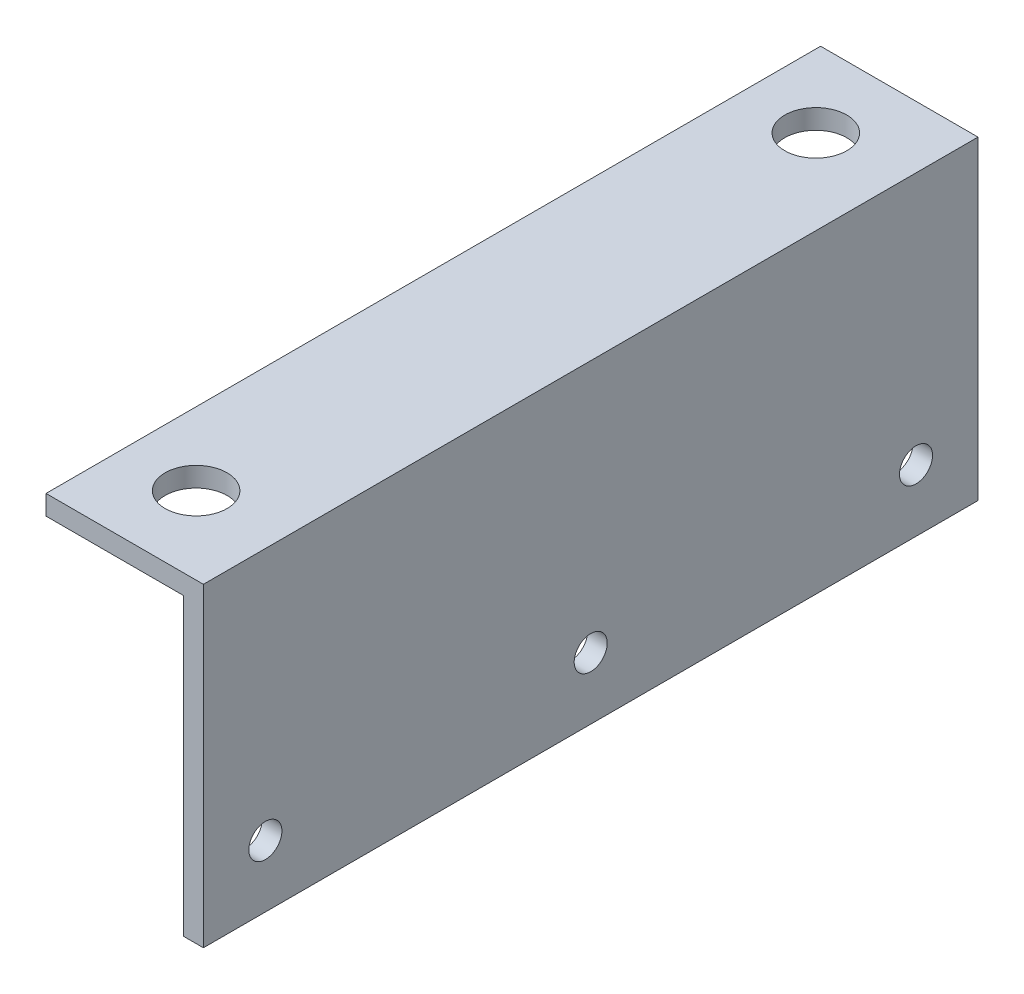
from build123d import *

# Parameters (mm, degrees)
BOSS_EXTRUDE1_DEPTH = 125
CUT_EXTRUDE1_REACH  = 139.298
SKETCH2_R           = 2.665
CUT_EXTRUDE2_REACH  = 139.298
SKETCH3_R           = 5


with BuildPart() as part:
    # Sketch1 → Boss-Extrude1 (new body)
    with BuildSketch(Plane.XY):
        Polygon((0, 0), (0, 50.8), (-25.4, 50.8), (-25.4, 47.625), (-3.175, 47.625), (-3.175, 0), align=None)
    extrude(amount=BOSS_EXTRUDE1_DEPTH)

    # Sketch2 → Cut-Extrude1 (cut, up to next)
    with BuildSketch(Plane(origin=(0, 0, 0), x_dir=(0, 0, -1), z_dir=(1, 0, 0)), mode=Mode.PRIVATE) as cut_extrude1_sk1:
        with Locations((-115, 10)):
            Circle(SKETCH2_R)
    cut_extrude1_tool1 = extrude(cut_extrude1_sk1.sketch, amount=-CUT_EXTRUDE1_REACH, mode=Mode.PRIVATE) & part.part
    # Sketch2 → Cut-Extrude1 (cut, up to next)
    with BuildSketch(Plane(origin=(0, 0, 0), x_dir=(0, 0, -1), z_dir=(1, 0, 0)), mode=Mode.PRIVATE) as cut_extrude1_sk2:
        with Locations((-10, 10)):
            Circle(SKETCH2_R)
    cut_extrude1_tool2 = extrude(cut_extrude1_sk2.sketch, amount=-CUT_EXTRUDE1_REACH, mode=Mode.PRIVATE) & part.part
    # Sketch2 → Cut-Extrude1 (cut, up to next)
    with BuildSketch(Plane(origin=(0, 0, 0), x_dir=(0, 0, -1), z_dir=(1, 0, 0)), mode=Mode.PRIVATE) as cut_extrude1_sk3:
        with Locations((-62.5, 10)):
            Circle(SKETCH2_R)
    cut_extrude1_tool3 = extrude(cut_extrude1_sk3.sketch, amount=-CUT_EXTRUDE1_REACH, mode=Mode.PRIVATE) & part.part
    add(cut_extrude1_tool1.solids().sort_by_distance((0, 10, 115))[0], mode=Mode.SUBTRACT)
    add(cut_extrude1_tool2.solids().sort_by_distance((0, 10, 10))[0], mode=Mode.SUBTRACT)
    add(cut_extrude1_tool3.solids().sort_by_distance((0, 10, 62.5))[0], mode=Mode.SUBTRACT)

    # Sketch3 → Cut-Extrude2 (cut, up to next)
    with BuildSketch(Plane(origin=(0, 50.8, 0), x_dir=(1, 0, 0), z_dir=(0, 1, 0)), mode=Mode.PRIVATE) as cut_extrude2_sk1:
        with Locations(Location((-13.675, -112.5, 0), (0, 0, 270))):
            Circle(SKETCH3_R)
    cut_extrude2_tool1 = extrude(cut_extrude2_sk1.sketch, amount=-CUT_EXTRUDE2_REACH, mode=Mode.PRIVATE) & part.part
    # Sketch3 → Cut-Extrude2 (cut, up to next)
    with BuildSketch(Plane(origin=(0, 50.8, 0), x_dir=(1, 0, 0), z_dir=(0, 1, 0)), mode=Mode.PRIVATE) as cut_extrude2_sk2:
        with BuildLine():
            ThreePointArc((-8.675, -12.5), (-10.139466094, -8.964466094), (-13.675, -7.5))
            ThreePointArc((-13.675, -7.5), (-18.675, -12.5), (-13.675, -17.5))
            ThreePointArc((-13.675, -17.5), (-10.139466094, -16.035533906), (-8.675, -12.5))
        make_face()
    cut_extrude2_tool2 = extrude(cut_extrude2_sk2.sketch, amount=-CUT_EXTRUDE2_REACH, mode=Mode.PRIVATE) & part.part
    add(cut_extrude2_tool1.solids().sort_by_distance((-13.675, 50.8, 112.5))[0], mode=Mode.SUBTRACT)
    add(cut_extrude2_tool2.solids().sort_by_distance((-13.675, 50.8, 12.5))[0], mode=Mode.SUBTRACT)


solid = part.part
